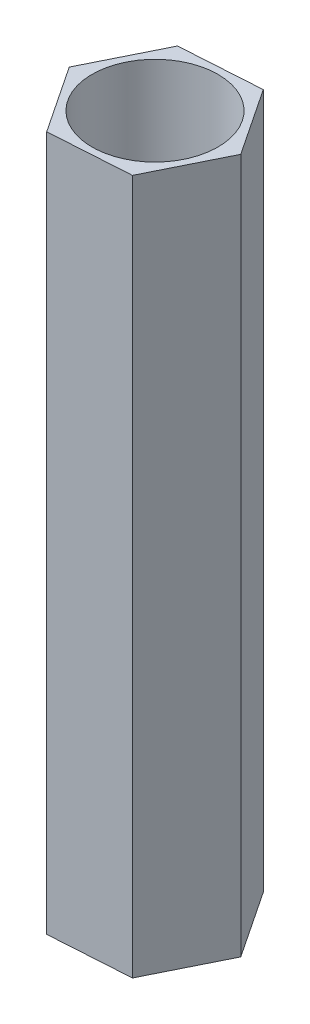
from build123d import *

# Parameters (mm, degrees)
SKETCH1_R           = 2.25
BOSS_EXTRUDE1_DEPTH = 24.83


with BuildPart() as part:
    # Sketch1 → Boss-Extrude1 (new body)
    with BuildSketch(Plane(origin=(0, 0, 0), x_dir=(1, 0, 0), z_dir=(0, 1, 0))):
        Polygon((1.598787763, -2.403582955), (2.880957781, 0.182799341), (1.282170017, 2.586382296), (-1.598787763, 2.403582955), (-2.880957781, -0.182799341), (-1.282170017, -2.586382296), align=None)
        with Locations(Location((0, 0, 0), (0, 0, 90))):
            Circle(SKETCH1_R, mode=Mode.SUBTRACT)
    extrude(amount=BOSS_EXTRUDE1_DEPTH)


solid = part.part
